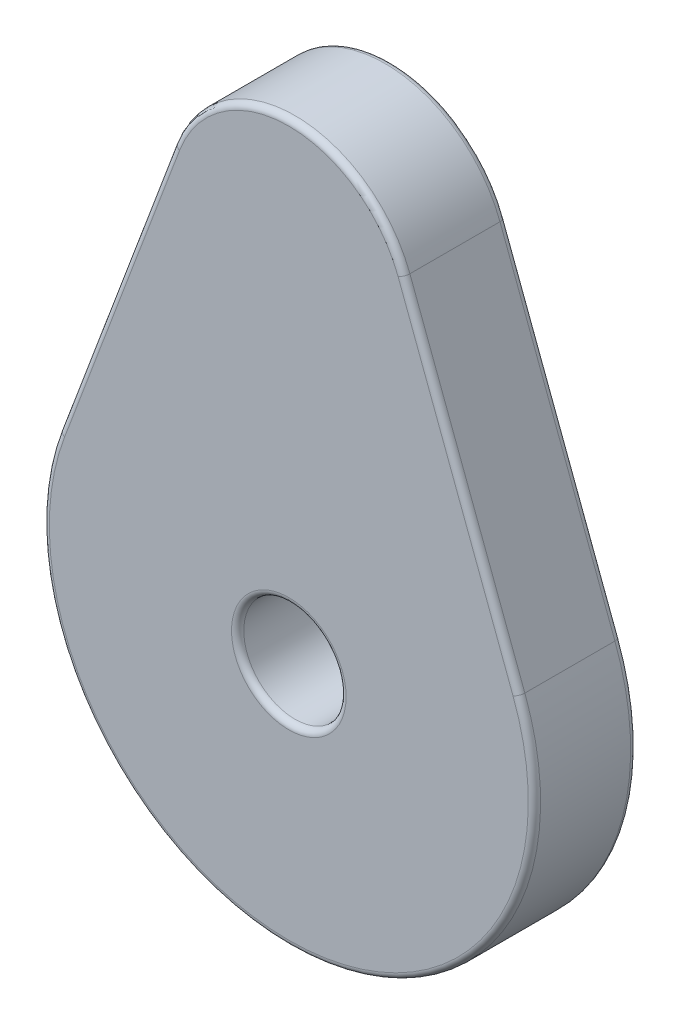
from build123d import *

# Parameters (mm, degrees)
SKETCH1_R           = 12.5
BOSS_EXTRUDE1_DEPTH = 12.5
FILLET1_R           = 1.5
FILLET2_R           = 1.5


with BuildPart() as part:
    # Sketch1 → Boss-Extrude1 (new, symmetric)
    with BuildSketch(Plane.XY):
        with BuildLine():
            Line((-56.159743046, 21.120683252), (-28.079871523, 95.784857261))
            ThreePointArc((-28.079871523, 95.784857261), (0, 115.224515635), (28.079871523, 95.784857261))
            Line((28.079871523, 95.784857261), (56.159743046, 21.120683252))
            ThreePointArc((56.159743046, 21.120683252), (0, -60), (-56.159743046, 21.120683252))
        make_face()
        Circle(SKETCH1_R, mode=Mode.SUBTRACT)
    extrude(amount=BOSS_EXTRUDE1_DEPTH, both=True)

    # Fillet1
    fillet1_edges = [part.edges().sort_by_distance(p)[0] for p in [
        (0, 115.224515635, 12.5),
        (-42.119807284, 58.452770256, 12.5),
        (0, -60, 12.5),
        (-42.119807284, 58.452770256, -12.5),
        (0, 115.224515635, -12.5),
        (42.119807284, 58.452770256, -12.5),
        (0, -60, -12.5),
        (42.119807284, 58.452770256, 12.5),
    ]]
    fillet(fillet1_edges, radius=FILLET1_R)

    # Fillet2
    fillet2_edges = [part.edges().sort_by_distance(p)[0] for p in [
        (-12.5, 0, -12.5),
        (-12.5, 0, 12.5),
    ]]
    fillet(fillet2_edges, radius=FILLET2_R)


solid = part.part
